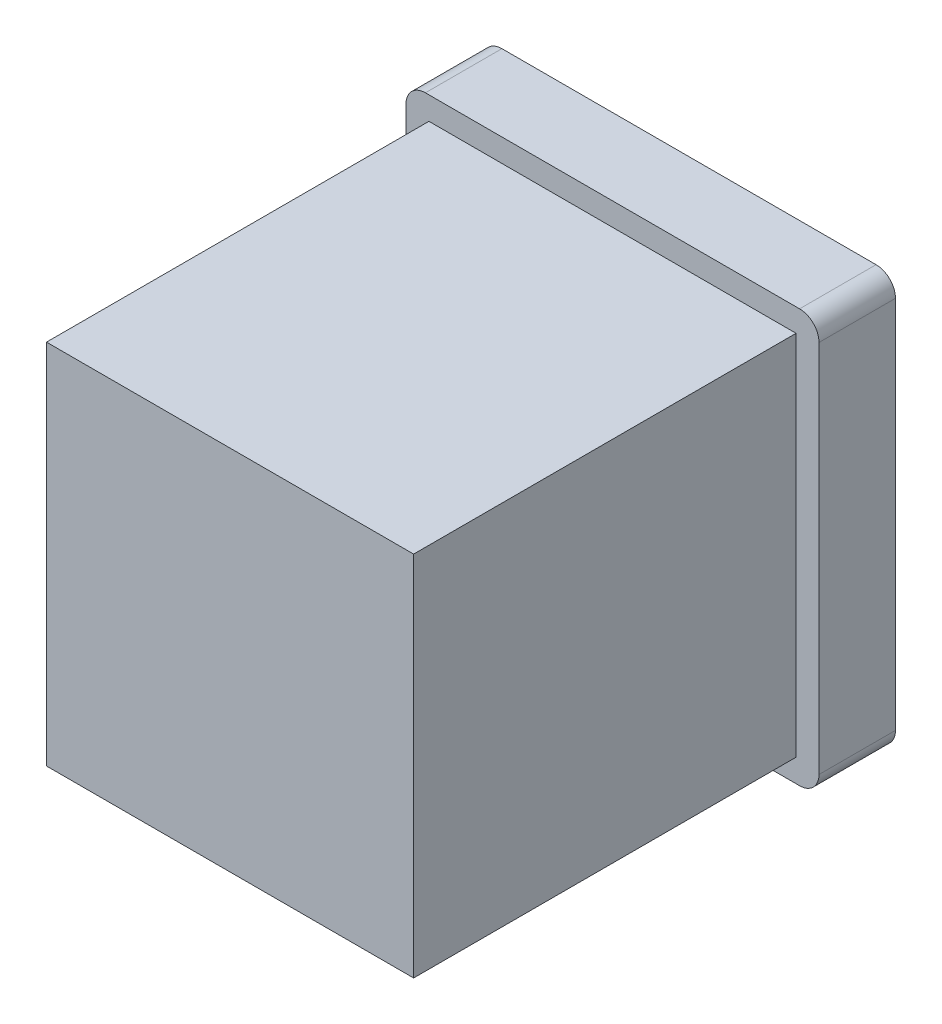
from build123d import *

# Parameters (mm, degrees)
SKETCH1_W           = 27
SKETCH1_H           = 27
BOSS_EXTRUDE1_DEPTH = 5
SKETCH2_W           = 24
SKETCH2_H           = 24
BOSS_EXTRUDE2_DEPTH = 25
FILLET1_R           = 1.27
SKETCH3_W           = 2.54
SKETCH3_H           = 7.62
CUT_EXTRUDE1_DEPTH  = 2.54


with BuildPart() as part:
    # Sketch1 → Boss-Extrude1 (new body)
    with BuildSketch(Plane.XY):
        with Locations((13.5, 13.5)):
            Rectangle(SKETCH1_W, SKETCH1_H)
    extrude(amount=BOSS_EXTRUDE1_DEPTH)

    # Sketch2 → Boss-Extrude2 (add)
    with BuildSketch(Plane.XY.offset(5)):
        with Locations((13.5, 13.5)):
            Rectangle(SKETCH2_W, SKETCH2_H)
    extrude(amount=BOSS_EXTRUDE2_DEPTH)

    # Fillet1
    fillet1_edges = [part.edges().sort_by_distance(p)[0] for p in [
        (0, 27, 2.5),
        (27, 27, 2.5),
        (27, 0, 2.5),
        (0, 0, 2.5),
    ]]
    fillet(fillet1_edges, radius=FILLET1_R)

    # Sketch3 → Cut-Extrude1 (cut)
    with BuildSketch(Plane(origin=(0, 0, 0), x_dir=(-1, 0, 0), z_dir=(0, 0, -1))):
        with Locations((-19.38, 19.38)):
            Rectangle(SKETCH3_W, SKETCH3_H)
        with Locations((-7.62, 19.38)):
            Rectangle(SKETCH3_W, SKETCH3_H)
        with BuildLine():
            Line((-16.164953657, 5.08), (-16.164953657, 8.636))
            ThreePointArc((-16.164953657, 8.636), (-13.624953657, 10.494493494), (-11.084953657, 8.636))
            Line((-11.084953657, 8.636), (-11.084953657, 5.08))
            Line((-11.084953657, 5.08), (-16.164953657, 5.08))
        make_face()
    extrude(amount=-CUT_EXTRUDE1_DEPTH, mode=Mode.SUBTRACT)


solid = part.part
